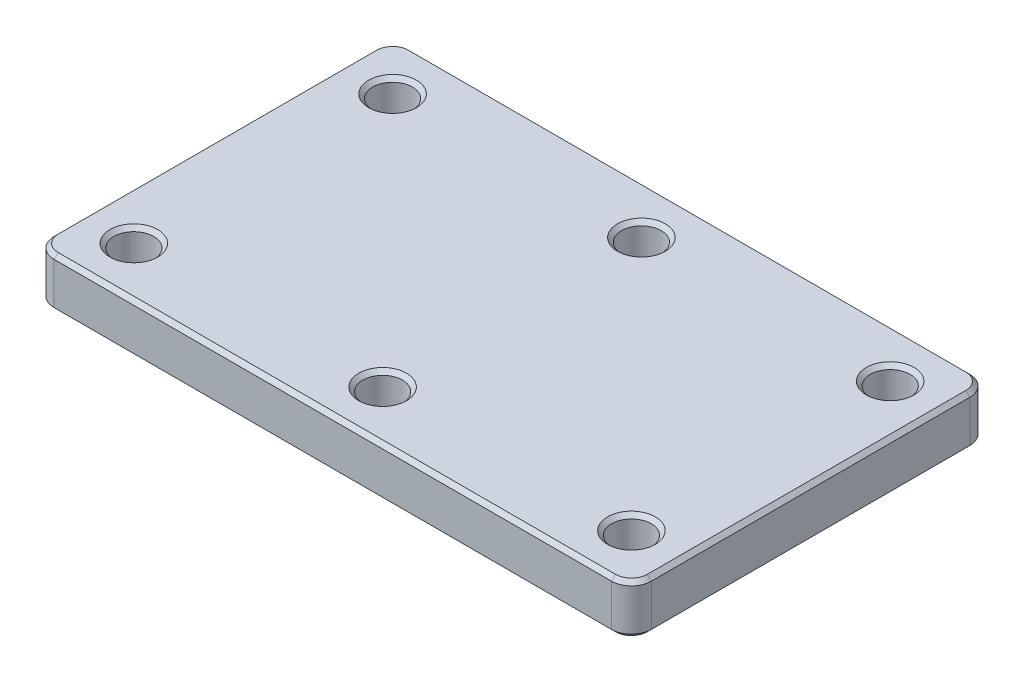
from build123d import *

# Parameters (mm, degrees)
SKETCH1_R           = 10
BOSS_EXTRUDE1_DEPTH = 25
CHAMFER1_SIZE       = 2
CHAMFER2_SIZE       = 2


with BuildPart() as part:
    # Sketch1 → Boss-Extrude1 (new body)
    with BuildSketch(Plane(origin=(0, 0, 0), x_dir=(1, 0, 0), z_dir=(0, 1, 0))):
        with BuildLine():
            Line((10, 0), (290, 0))
            ThreePointArc((290, 0), (297.071067812, 2.928932188), (300, 10))
            Line((300, 10), (300, 170))
            ThreePointArc((300, 170), (297.071067812, 177.071067812), (290, 180))
            Line((290, 180), (10, 180))
            ThreePointArc((10, 180), (2.928932188, 177.071067812), (0, 170))
            Line((0, 170), (0, 10))
            ThreePointArc((0, 10), (2.928932188, 2.928932188), (10, 0))
        make_face()
        with Locations(Location((25, 155, 0), (0, 0, 270))):
            Circle(SKETCH1_R, mode=Mode.SUBTRACT)
        with Locations(Location((150, 155, 0), (0, 0, 270))):
            Circle(SKETCH1_R, mode=Mode.SUBTRACT)
        with Locations(Location((275, 155, 0), (0, 0, 270))):
            Circle(SKETCH1_R, mode=Mode.SUBTRACT)
        with Locations(Location((150, 25, 0), (0, 0, 270))):
            Circle(SKETCH1_R, mode=Mode.SUBTRACT)
        with Locations(Location((275, 25, 0), (0, 0, 270))):
            Circle(SKETCH1_R, mode=Mode.SUBTRACT)
        with Locations(Location((25, 25, 0), (0, 0, 270))):
            Circle(SKETCH1_R, mode=Mode.SUBTRACT)
    extrude(amount=BOSS_EXTRUDE1_DEPTH)

    # Chamfer1
    chamfer1_edges = [part.edges().sort_by_distance(p)[0] for p in [
        (2.928932188, 25, -177.071067812),
        (0, 25, -90),
        (2.928932188, 25, -2.928932188),
        (25, 25, -165),
        (150, 25, 0),
        (150, 25, -165),
        (297.071067812, 25, -2.928932188),
        (275, 25, -165),
        (300, 25, -90),
        (150, 25, -35),
        (275, 25, -35),
        (25, 25, -35),
        (297.071067812, 25, -177.071067812),
        (150, 25, -180),
    ]]
    chamfer(chamfer1_edges, length=CHAMFER1_SIZE)

    # Chamfer2
    chamfer2_edges = [part.edges().sort_by_distance(p)[0] for p in [
        (0, 0, -90),
        (2.928932188, 0, -177.071067812),
        (150, 0, -180),
        (297.071067812, 0, -177.071067812),
        (25, 0, -165),
        (150, 0, -165),
        (275, 0, -165),
        (150, 0, -35),
        (275, 0, -35),
        (25, 0, -35),
        (300, 0, -90),
        (297.071067812, 0, -2.928932188),
        (150, 0, 0),
        (2.928932188, 0, -2.928932188),
    ]]
    chamfer(chamfer2_edges, length=CHAMFER2_SIZE)


solid = part.part
